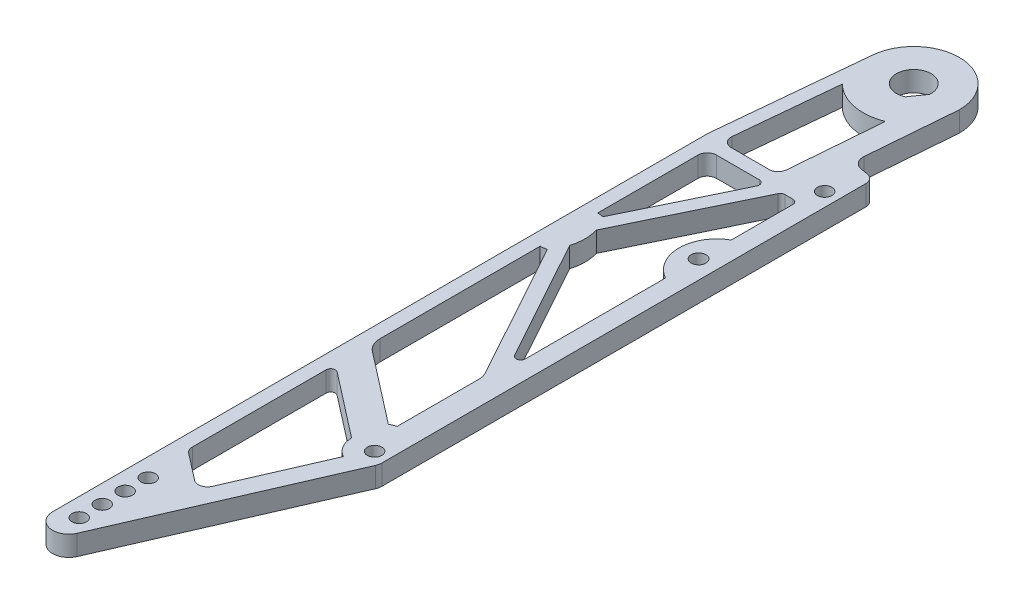
from build123d import *

# Parameters (mm, degrees)
SKETCH2_R           = 2
SKETCH2_R_2         = 1.999999991
BOSS_EXTRUDE1_DEPTH = 5.588
SKETCH7_R           = 2.032
CUT_EXTRUDE1_DEPTH  = 5.588


with BuildPart() as part:
    # Sketch2 → Boss-Extrude1 (new body)
    with BuildSketch(Plane(origin=(0, 0, 0), x_dir=(1, 0, 0), z_dir=(0, 1, 0))):
        with BuildLine():
            ThreePointArc((17.295902343, -30.526810701), (16.688093876, -28.878103365), (15.15555913, -28.018449791))
            Line((15.15555913, -28.018449791), (13.238676936, -27.713033224))
            ThreePointArc((13.238676936, -27.713033224), (11.241051513, -26.538356195), (10.573787778, -24.319092227))
            Line((10.573787778, -24.319092227), (12.5603, 0))
            ThreePointArc((12.5603, 0), (0.603657177, 12.545785512), (-12.502275592, 1.2059192))
            Line((-12.502275592, 1.2059192), (-16.498266045, -40.222207921))
            ThreePointArc((-16.498266045, -40.222207921), (-16.507064815, -40.344000039), (-16.51, -40.466074291))
            Line((-16.51, -40.466074291), (-16.51, -221.328861788))
            ThreePointArc((-16.51, -221.328861788), (-12.970187584, -225.680718913), (-7.988667969, -223.101301399))
            Line((-7.988667969, -223.101301399), (16.979901226, -165.677523619))
            ThreePointArc((16.979901226, -165.677523619), (17.216065593, -164.934164738), (17.295902343, -164.158289667))
            Line((17.295902343, -164.158289667), (17.295902343, -30.526810701))
        make_face()
        with Locations(Location((-11.43, -219.075, 0), (0, 0, 270))):
            Circle(SKETCH2_R, mode=Mode.SUBTRACT)
        with Locations(Location((-11.43, -212.725, 0), (0, 0, 270))):
            Circle(SKETCH2_R, mode=Mode.SUBTRACT)
        with Locations(Location((-11.43, -206.375, 0), (0, 0, 270))):
            Circle(SKETCH2_R, mode=Mode.SUBTRACT)
        with Locations(Location((-11.43, -200.025, 0), (0, 0, 270))):
            Circle(SKETCH2_R, mode=Mode.SUBTRACT)
        with BuildLine():
            ThreePointArc((7.135902343, -162.410770806), (8.023611961, -165.648962244), (10.438542905, -167.981776143))
            Line((10.438542905, -167.981776143), (-0.534170778, -193.217289931))
            ThreePointArc((-0.534170778, -193.217289931), (-2.234040931, -194.665234867), (-4.420389569, -194.211381682))
            Line((-4.420389569, -194.211381682), (-11.716886202, -188.551043102))
            ThreePointArc((-11.716886202, -188.551043102), (-12.441018517, -187.661516081), (-12.7, -186.544128716))
            Line((-12.7, -186.544128716), (-12.7, -149.615408258))
            ThreePointArc((-12.7, -149.615408258), (-11.988693683, -148.474898999), (-10.651556899, -148.611951065))
            Line((-10.651556899, -148.611951065), (7.135902343, -162.410770806))
        make_face(mode=Mode.SUBTRACT)
        with BuildLine():
            ThreePointArc((10.656105825, -153.315833936), (9.771695946, -153.639779081), (8.923603828, -154.049487576))
            Line((8.923603828, -154.049487576), (-10.733772403, -138.80005889))
            ThreePointArc((-10.733772403, -138.80005889), (-12.182037035, -137.021004847), (-12.7, -134.786230117))
            Line((-12.7, -134.786230117), (-12.7, -90.4875))
            ThreePointArc((-12.7, -90.4875), (-11.803536501, -90.43671411), (-10.918544548, -90.285006317))
            Line((-10.918544548, -90.285006317), (10.027134635, -128.362607876))
            ThreePointArc((10.027134635, -128.362607876), (10.49635106, -129.547067395), (10.656105825, -130.811024207))
            Line((10.656105825, -130.811024207), (10.656105825, -153.315833936))
        make_face(mode=Mode.SUBTRACT)
        with Locations(Location((13.485902343, -162.410770806, 0), (0, 0, 270))):
            Circle(SKETCH2_R, mode=Mode.SUBTRACT)
        with BuildLine():
            Line((-10.16, -44.337182032), (1.663048834, -44.337182032))
            ThreePointArc((1.663048834, -44.337182032), (2.739129831, -44.932682449), (2.806066447, -46.160725831))
            Line((2.806066447, -46.160725831), (-11.055993219, -74.784618621))
            ThreePointArc((-11.055993219, -74.784618621), (-11.873503915, -74.655646925), (-12.7, -74.6125))
            Line((-12.7, -74.6125), (-12.7, -46.877182032))
            ThreePointArc((-12.7, -46.877182032), (-11.956051224, -45.081130808), (-10.16, -44.337182032))
        make_face(mode=Mode.SUBTRACT)
        with BuildLine():
            ThreePointArc((-9.903213406, -40.527182032), (-11.783508673, -39.694838236), (-12.431479451, -37.743315662))
            Line((-12.431479451, -37.743315662), (-9.755434212, -9.99962016))
            ThreePointArc((-9.755434212, -9.99962016), (-2.756273581, -13.695395429), (5.127655889, -12.99492382))
            Line((5.127655889, -12.99492382), (3.069264048, -38.19397392))
            ThreePointArc((3.069264048, -38.19397392), (2.259083254, -39.854914801), (0.537695935, -40.527182032))
            Line((0.537695935, -40.527182032), (-9.903213406, -40.527182032))
        make_face(mode=Mode.SUBTRACT)
        with BuildLine():
            Line((4.757028922, -0.416186103), (2.018086723, -4.327800945))
            ThreePointArc((2.018086723, -4.327800945), (-3.911614842, 2.738942199), (4.757028922, -0.416186103))
        make_face(mode=Mode.SUBTRACT)
        with BuildLine():
            ThreePointArc((-8.804706991, -86.222769023), (-8.262040897, -82.55), (-8.804706991, -78.877230977))
            Line((-8.804706991, -78.877230977), (7.575478058, -45.053638233))
            ThreePointArc((7.575478058, -45.053638233), (8.043996088, -44.531101035), (8.718495671, -44.337182032))
            Line((8.718495671, -44.337182032), (10.945902343, -44.337182032))
            ThreePointArc((10.945902343, -44.337182032), (11.843927955, -44.70915642), (12.215902343, -45.607182032))
            Line((12.215902343, -45.607182032), (12.215902343, -62.618124667))
            ThreePointArc((12.215902343, -62.618124667), (6.881902343, -71.709053992), (12.215902343, -80.799983318))
            Line((12.215902343, -80.799983318), (12.215902343, -119.492817968))
            ThreePointArc((12.215902343, -119.492817968), (11.261891546, -120.722879277), (9.83314514, -120.104922051))
            Line((9.83314514, -120.104922051), (-8.804706991, -86.222769023))
        make_face(mode=Mode.SUBTRACT)
        with Locations(Location((13.485902343, -38.1, 0), (0, 0, 270))):
            Circle(SKETCH2_R_2, mode=Mode.SUBTRACT)
    extrude(amount=BOSS_EXTRUDE1_DEPTH)

    # Sketch7 → Cut-Extrude1 (cut)
    with BuildSketch(Plane(origin=(0, 5.588, 0), x_dir=(1, 0, 0), z_dir=(0, 1, 0))):
        with Locations(Location((12.215902343, -71.655983318, 0), (0, 0, 270))):
            Circle(SKETCH7_R)
    extrude(amount=-CUT_EXTRUDE1_DEPTH, mode=Mode.SUBTRACT)


solid = part.part
